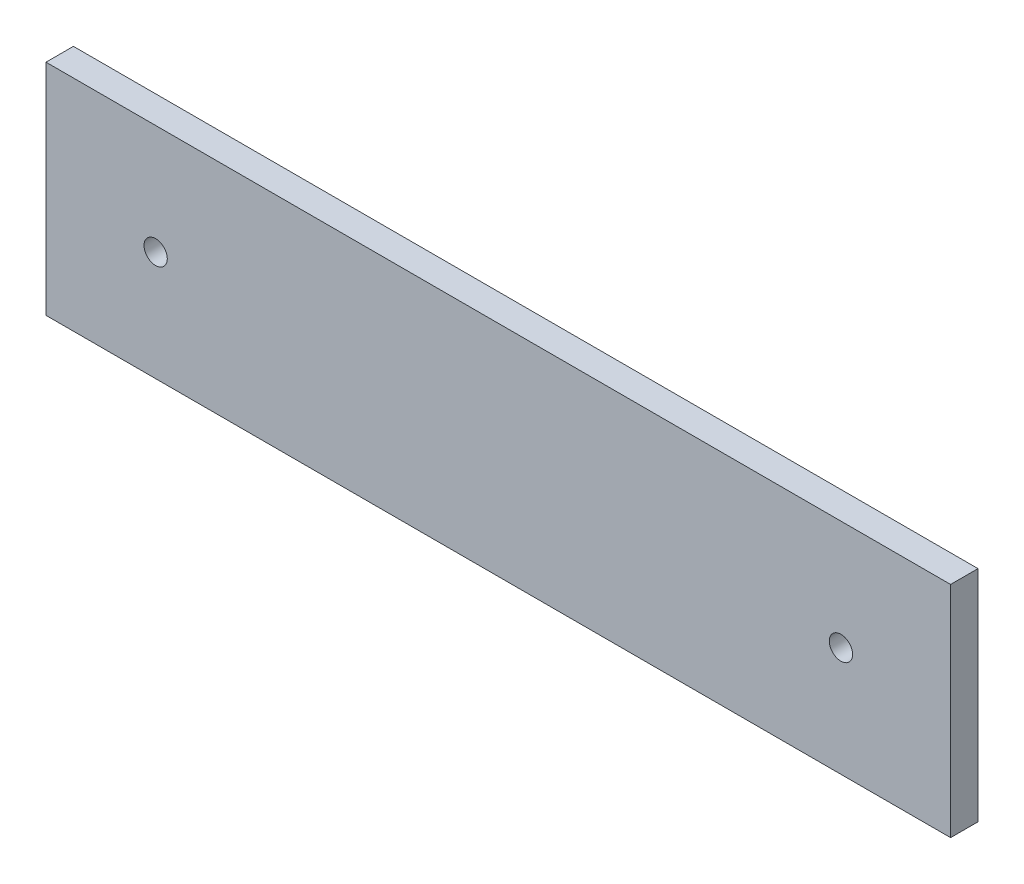
from build123d import *

# Parameters (mm, degrees)
SKETCH_1_W      = 132
SKETCH_1_H      = 32
SKETCH_1_R      = 1.7
EXTRUDE_1_DEPTH = 2


with BuildPart() as part:
    # 草图1 → 凸台-拉伸1 (new, symmetric)
    with BuildSketch(Plane.XY):
        with Locations((50, 0)):
            Rectangle(SKETCH_1_W, SKETCH_1_H)
        Circle(SKETCH_1_R, mode=Mode.SUBTRACT)
        with Locations((100, 0)):
            Circle(SKETCH_1_R, mode=Mode.SUBTRACT)
    extrude(amount=EXTRUDE_1_DEPTH, both=True)


solid = part.part
